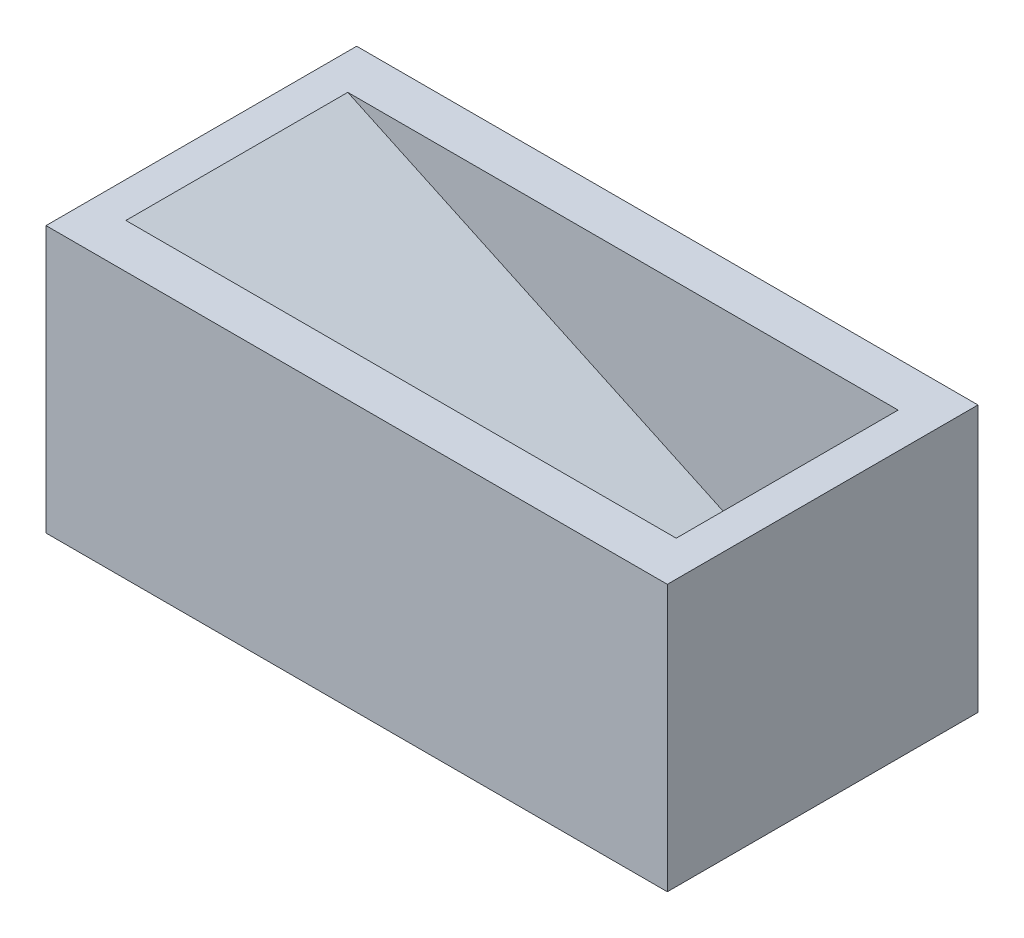
from build123d import *

# Parameters (mm, degrees)
SKETCH1_W           = 35
SKETCH1_H           = 17.5
BOSS_EXTRUDE2_DEPTH = 7.5
CUT_EXTRUDE2_DEPTH  = 6.25


with BuildPart() as part:
    # Sketch1 → Boss-Extrude2 (new, symmetric)
    with BuildSketch(Plane(origin=(0, 0, 0), x_dir=(1, 0, 0), z_dir=(0, 1, 0))):
        Rectangle(SKETCH1_W, SKETCH1_H)
    extrude(amount=BOSS_EXTRUDE2_DEPTH, both=True)

    # Sketch5 → Cut-Extrude2 (cut, symmetric)
    with BuildSketch(Plane.XY):
        Polygon((-15.5, 7.5), (9.96320795, -4.373688868), (15.5, 7.5), align=None)
    extrude(amount=CUT_EXTRUDE2_DEPTH, both=True, mode=Mode.SUBTRACT)


solid = part.part
